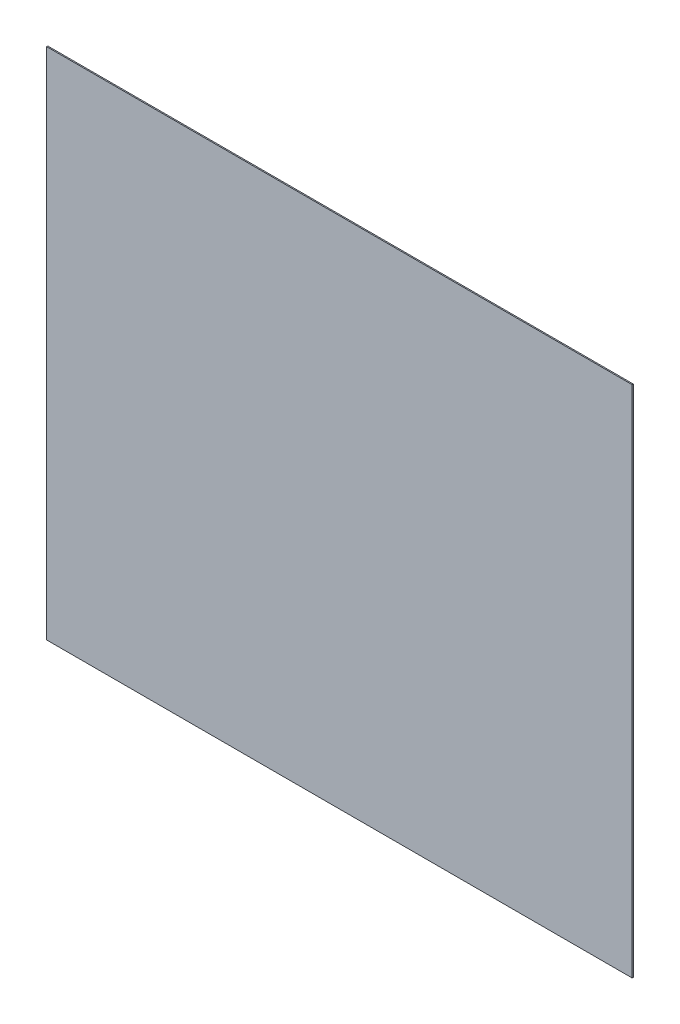
from build123d import *

# Parameters (mm, degrees)
CROQUIS1_W              = 1481.2
CROQUIS1_H              = 1300
SALIENTE_EXTRUIR1_DEPTH = 2.9


with BuildPart() as part:
    # Croquis1 → Saliente-Extruir1 (new body)
    with BuildSketch(Plane.XY):
        with Locations((740.6, -650)):
            Rectangle(CROQUIS1_W, CROQUIS1_H)
    extrude(amount=SALIENTE_EXTRUIR1_DEPTH)


solid = part.part
